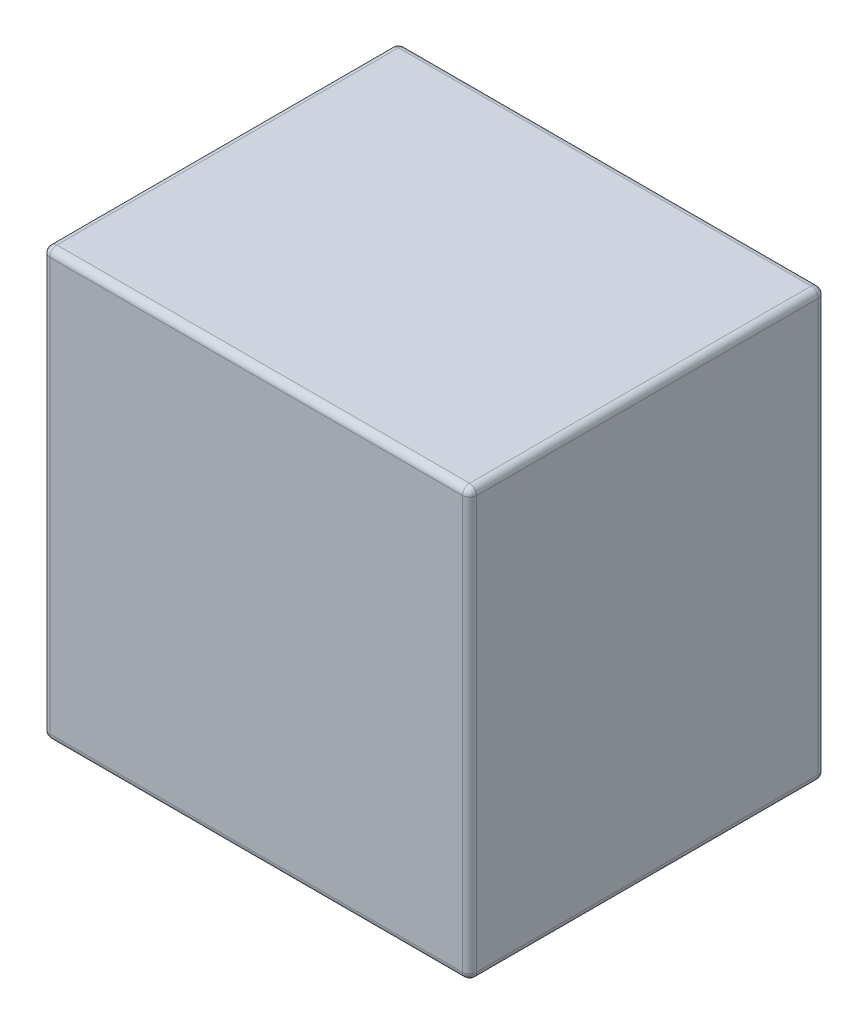
from build123d import *

# Parameters (mm, degrees)
SKETCH1_W           = 6
SKETCH1_H           = 6
BOSS_EXTRUDE1_DEPTH = 5
FILLET1_R           = 0.1


with BuildPart() as part:
    # Sketch1 → Boss-Extrude1 (new body)
    with BuildSketch(Plane(origin=(0, 0, 0), x_dir=(0, 1, 0), z_dir=(0, 0, 1))):
        Rectangle(SKETCH1_W, SKETCH1_H)
    extrude(amount=BOSS_EXTRUDE1_DEPTH)

    # Fillet1
    fillet1_edges = [part.edges().sort_by_distance(p)[0] for p in [
        (0, -3, 5),
        (3, 0, 5),
        (0, 3, 5),
        (3, 0, 0),
        (0, -3, 0),
        (-3, 0, 0),
        (0, 3, 0),
        (3, 3, 2.5),
        (3, -3, 2.5),
        (-3, -3, 2.5),
        (-3, 3, 2.5),
        (-3, 0, 5),
    ]]
    fillet(fillet1_edges, radius=FILLET1_R)


solid = part.part
